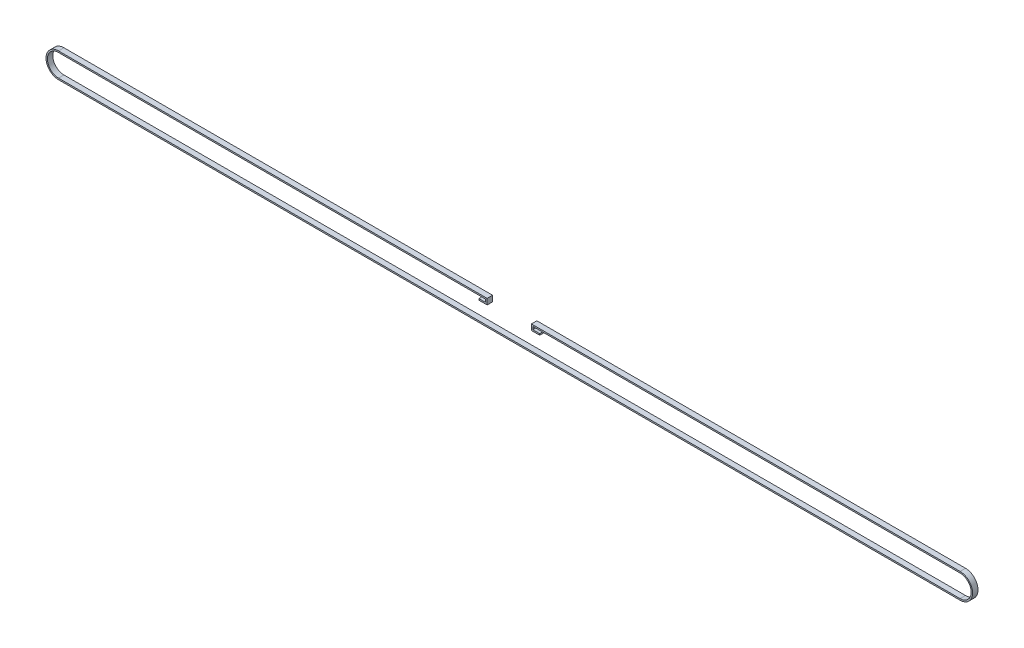
from build123d import *

# Parameters (mm, degrees)
BOSS_EXTRUDE1_DEPTH = 4.7625
SKETCH2_W           = 80
SKETCH2_H           = 2.5
CUT_EXTRUDE1_DEPTH  = 4.7625
BOSS_EXTRUDE2_DEPTH = 9.525


with BuildPart() as part:
    # Sketch1 → Boss-Extrude1 (new, symmetric)
    with BuildSketch(Plane.XY):
        with BuildLine():
            Line((-790, 21.9056), (790, 21.9056))
            ThreePointArc((790, 21.9056), (811.9056, 0), (790, -21.9056))
            Line((790, -21.9056), (-790, -21.9056))
            ThreePointArc((-790, -21.9056), (-811.9056, 0), (-790, 21.9056))
        make_face()
        with BuildLine():
            Line((-790, -19.4056), (790, -19.4056))
            ThreePointArc((790, -19.4056), (809.4056, 0), (790, 19.4056))
            Line((790, 19.4056), (-790, 19.4056))
            ThreePointArc((-790, 19.4056), (-809.4056, 0), (-790, -19.4056))
        make_face(mode=Mode.SUBTRACT)
    extrude(amount=BOSS_EXTRUDE1_DEPTH, both=True)

    # Sketch2 → Cut-Extrude1 (cut, symmetric)
    with BuildSketch(Plane.XY):
        with Locations((0, 20.6556)):
            Rectangle(SKETCH2_W, SKETCH2_H)
    extrude(amount=CUT_EXTRUDE1_DEPTH, both=True, mode=Mode.SUBTRACT)

    # Sketch3 → Boss-Extrude2 (add)
    with BuildSketch(Plane.XY.offset(4.7625)):
        Polygon((-41.25, 21.9056), (-38.75, 21.9056), (-38.75, 11.9056), (-53.25, 11.9056), (-53.25, 14.4056), (-41.25, 14.4056), align=None)
        Polygon((53.25, 11.9056), (38.75, 11.9056), (38.75, 21.9056), (41.25, 21.9056), (41.25, 14.4056), (53.25, 14.4056), align=None)
    extrude(amount=-BOSS_EXTRUDE2_DEPTH)


solid = part.part
